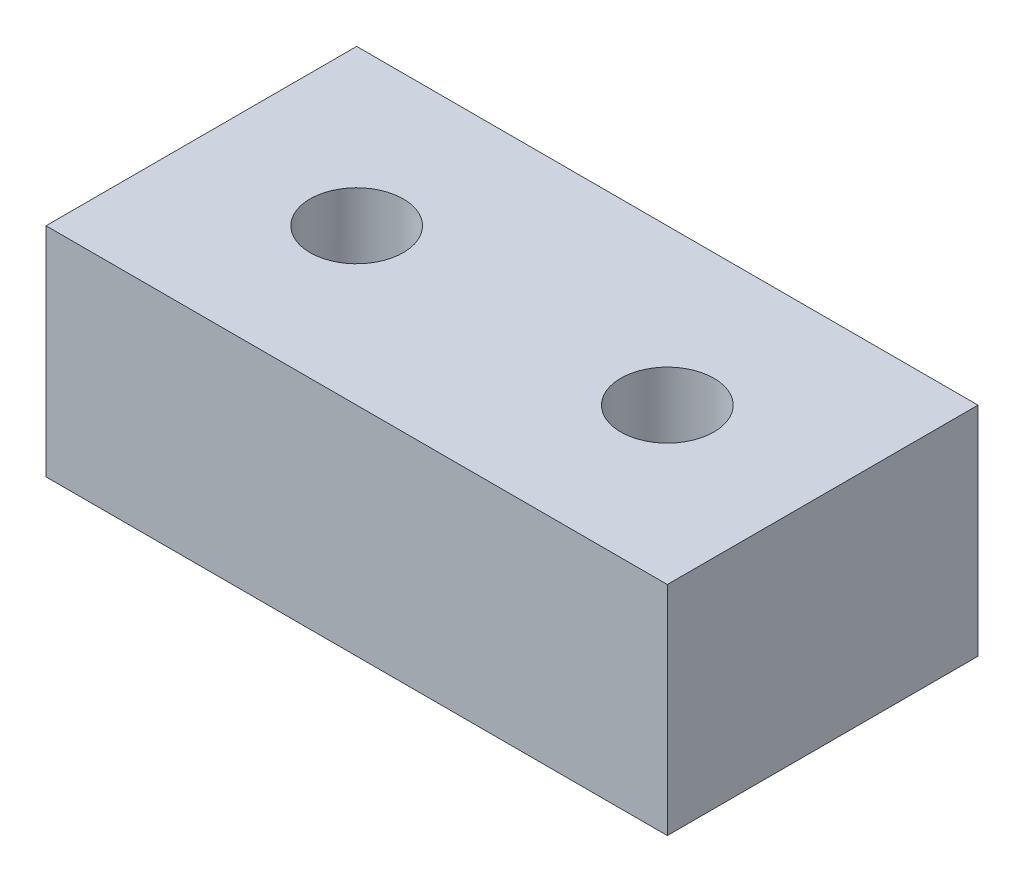
from build123d import *

# Parameters (mm, degrees)
SKETCH1_W           = 20
SKETCH1_H           = 10
BOSS_EXTRUDE1_DEPTH = 7
SKETCH2_R           = 1.5
CUT_EXTRUDE1_DEPTH  = 10


with BuildPart() as part:
    # Sketch1 → Boss-Extrude1 (new body)
    with BuildSketch(Plane(origin=(0, 0, 0), x_dir=(1, 0, 0), z_dir=(0, 1, 0))):
        Rectangle(SKETCH1_W, SKETCH1_H)
    extrude(amount=BOSS_EXTRUDE1_DEPTH)

    # Sketch2 → Cut-Extrude1 (cut)
    with BuildSketch(Plane(origin=(0, 7, 0), x_dir=(1, 0, 0), z_dir=(0, 1, 0))):
        with Locations(Location((-5, 0, 0), (0, 0, 270))):
            Circle(SKETCH2_R)
        with Locations(Location((5, 0, 0), (0, 0, 90))):
            Circle(SKETCH2_R)
    extrude(amount=-CUT_EXTRUDE1_DEPTH, mode=Mode.SUBTRACT)


solid = part.part
